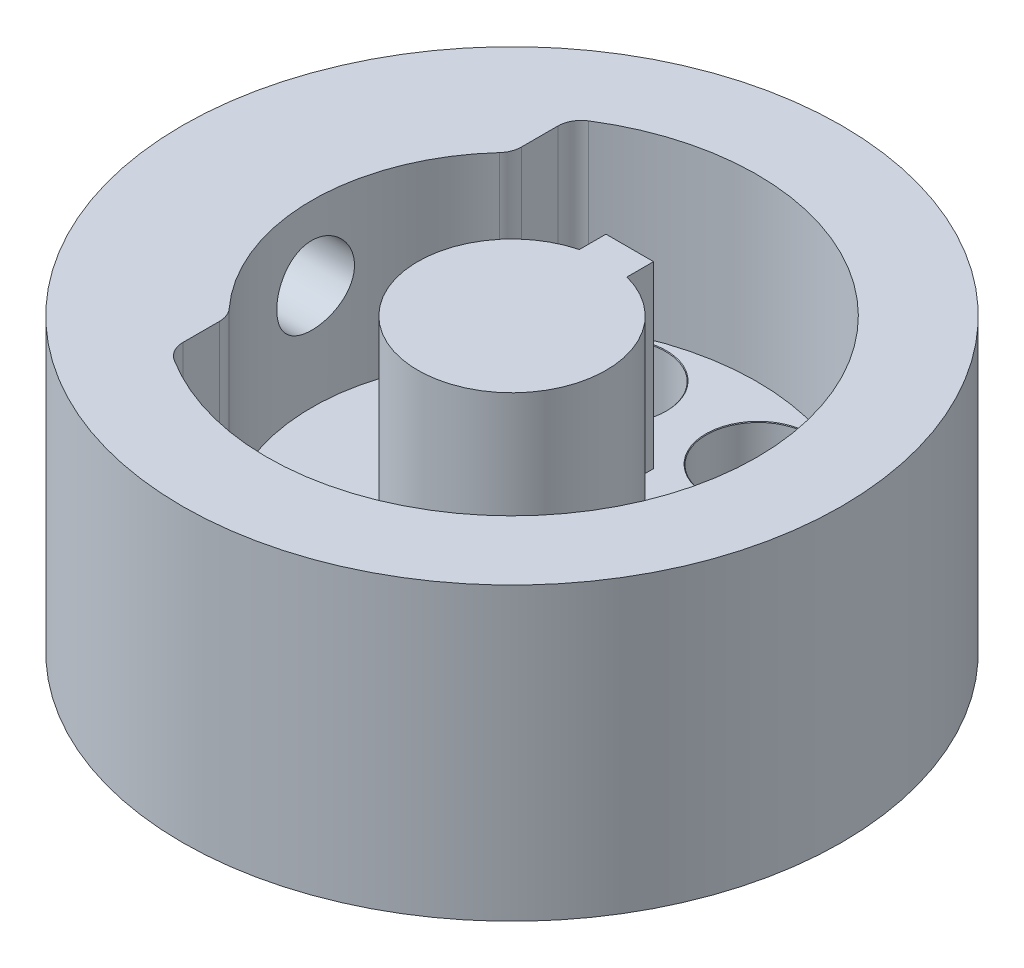
from build123d import *

# Parameters (mm, degrees)
SKETCH1_R                             = 14
BOSS_EXTRUDE1_DEPTH                   = 4.75
BOSS_EXTRUDE4_DEPTH                   = 7.61416499
BOSS_EXTRUDE5_START                   = 7.61416499
SKETCH5_R                             = 14
BOSS_EXTRUDE5_DEPTH                   = 7.61416499
TAP_DRILL_FOR_M4X0_7_TAP2_D           = 3.3
TAP_DRILL_FOR_M4X0_7_TAP2_DEPTH       = 13.749
TAP_DRILL_FOR_M4X0_7_TAP2_CSINK_D     = 3.35
TAP_DRILL_FOR_M4X0_7_TAP2_CSINK_ANGLE = 90
TAP_DRILL_FOR_M4X0_7_TAP2_TIP         = 0.991420021
FILLET2_R                             = 1
CBORE_FOR_M2_SHCS3_AT_2_COUNT         = 2
CBORE_FOR_M2_SHCS3_AT_2_PITCH         = 6.122934918
CBORE_FOR_M2_SHCS3_AT_3_COUNT         = 2
CBORE_FOR_M2_SHCS3_AT_3_PITCH         = 11.313708499
CBORE_FOR_M2_SHCS3_AT_4_COUNT         = 2
CBORE_FOR_M2_SHCS3_AT_4_PITCH         = 14.78207252
CBORE_FOR_M2_SHCS3_AT_5_COUNT         = 2
CBORE_FOR_M2_SHCS3_AT_5_PITCH         = 16
CBORE_FOR_M2_SHCS3_AT_6_COUNT         = 2
CBORE_FOR_M2_SHCS3_AT_6_PITCH         = 14.78207252
SKETCH20_R                            = 4
CUT_EXTRUDE2_DEPTH                    = 2.75
SKETCH21_R                            = 2
CUT_EXTRUDE3_DEPTH                    = 2.5


with BuildPart() as part:
    # Sketch1 → Boss-Extrude1 (new body)
    with BuildSketch(Plane(origin=(0, 0, 0), x_dir=(1, 0, 0), z_dir=(0, 1, 0))):
        with Locations(Location((0, 0, 0), (0, 0, 270))):
            Circle(SKETCH1_R)
    extrude(amount=-BOSS_EXTRUDE1_DEPTH)

    # Sketch4 → Boss-Extrude4 (add)
    with BuildSketch(Plane(origin=(0, 0, 0), x_dir=(1, 0, 0), z_dir=(0, 1, 0))):
        with BuildLine():
            ThreePointArc((4, 0), (3.165438358, 2.445403852), (1.01, 3.870387577))
            Line((1.01, 3.870387577), (-1.01, 3.870387577))
            ThreePointArc((-1.01, 3.870387577), (-2.445403852, -3.165438358), (4, 0))
        make_face()
        with BuildLine():
            Line((-1.01, 3.870387577), (1.01, 3.870387577))
            ThreePointArc((1.01, 3.870387577), (0, 4), (-1.01, 3.870387577))
        make_face()
        with BuildLine():
            Line((1.01, 3.870387577), (1.01, 4.999999997))
            Line((1.01, 4.999999997), (-1.01, 4.999999997))
            Line((-1.01, 4.999999997), (-1.01, 3.870387577))
            ThreePointArc((-1.01, 3.870387577), (0, 4), (1.01, 3.870387577))
        make_face()
    extrude(amount=BOSS_EXTRUDE4_DEPTH)

    # Sketch5 → Boss-Extrude5 (add)
    with BuildSketch(Plane(origin=(0, 0, 0), x_dir=(1, 0, 0), z_dir=(0, 1, 0)).offset(BOSS_EXTRUDE5_START)):
        with Locations(Location((0, 0, 0), (0, 0, 270))):
            Circle(SKETCH5_R)
        with BuildLine():
            ThreePointArc((-6.01040764, 8.487343518), (10.4, 0), (-6.01040764, -8.487343518))
            Line((-6.01040764, -8.487343518), (-6.01040764, -6.01040764))
            ThreePointArc((-6.01040764, -6.01040764), (-8.5, 0), (-6.01040764, 6.01040764))
            Line((-6.01040764, 6.01040764), (-6.01040764, 8.487343518))
        make_face(mode=Mode.SUBTRACT)
    extrude(amount=-BOSS_EXTRUDE5_DEPTH)

    # Tap Drill for M4x0.7 Tap2
    with Locations(Plane(origin=(-20, 0, 0), x_dir=(0, 0, -1), z_dir=(-1, 0, 0))):
        with Locations((0, -4.48916499)):
            CounterSinkHole(TAP_DRILL_FOR_M4X0_7_TAP2_D / 2, TAP_DRILL_FOR_M4X0_7_TAP2_CSINK_D / 2, depth=TAP_DRILL_FOR_M4X0_7_TAP2_DEPTH, counter_sink_angle=TAP_DRILL_FOR_M4X0_7_TAP2_CSINK_ANGLE)
            with Locations((0, 0, -(TAP_DRILL_FOR_M4X0_7_TAP2_DEPTH + TAP_DRILL_FOR_M4X0_7_TAP2_TIP / 2))):  # 118° drill point
                Cone(0, TAP_DRILL_FOR_M4X0_7_TAP2_D / 2, TAP_DRILL_FOR_M4X0_7_TAP2_TIP, mode=Mode.SUBTRACT)

    # Fillet2
    fillet2_edges = [part.edges().sort_by_distance(p)[0] for p in [
        (-6.01040764, 3.807082495, -8.487343518),
        (-6.01040764, 3.807082495, 8.487343518),
        (-6.01040764, 3.807082495, 6.01040764),
        (-6.01040764, 3.807082495, -6.01040764),
    ]]
    fillet(fillet2_edges, radius=FILLET2_R)

    # Sketch19 → CBORE for M2 SHCS3 (revolve, cut)
    with BuildSketch(Plane(origin=(-3.061467459, 0, -7.39103626), x_dir=(0, 0, 1), z_dir=(1, 0, 0))):
        Polygon((0, 0), (0, 5.471032743), (1.2, 4.75), (1.2, 3.5), (2.2, 3.5), (2.2, 0.025), (2.225, 0), align=None)
    cbore_for_m2_shcs3 = revolve(axis=Axis((-3.061467459, 6.35, -7.39103626), (0, -1, 0)), mode=Mode.SUBTRACT)

    # CBORE for M2 SHCS3 at 2: CBORE for M2 SHCS3 ×2
    with Locations(*[(i * CBORE_FOR_M2_SHCS3_AT_2_PITCH, 0, 0) for i in range(1, CBORE_FOR_M2_SHCS3_AT_2_COUNT)]):
        add(cbore_for_m2_shcs3, mode=Mode.SUBTRACT)

    # CBORE for M2 SHCS3 at 3: CBORE for M2 SHCS3 ×2
    with Locations(*[Vector(0.9238795325112845, 0, 0.38268343236509533) * (i * CBORE_FOR_M2_SHCS3_AT_3_PITCH) for i in range(1, CBORE_FOR_M2_SHCS3_AT_3_COUNT)]):
        add(cbore_for_m2_shcs3, mode=Mode.SUBTRACT)

    # CBORE for M2 SHCS3 at 4: CBORE for M2 SHCS3 ×2
    with Locations(*[Vector(0.7071067811865439, 0, 0.7071067811865512) * (i * CBORE_FOR_M2_SHCS3_AT_4_PITCH) for i in range(1, CBORE_FOR_M2_SHCS3_AT_4_COUNT)]):
        add(cbore_for_m2_shcs3, mode=Mode.SUBTRACT)

    # CBORE for M2 SHCS3 at 5: CBORE for M2 SHCS3 ×2
    with Locations(*[Vector(0.3826834323650841, 0, 0.9238795325112892) * (i * CBORE_FOR_M2_SHCS3_AT_5_PITCH) for i in range(1, CBORE_FOR_M2_SHCS3_AT_5_COUNT)]):
        add(cbore_for_m2_shcs3, mode=Mode.SUBTRACT)

    # CBORE for M2 SHCS3 at 6: CBORE for M2 SHCS3 ×2
    with Locations(*[(0, 0, i * CBORE_FOR_M2_SHCS3_AT_6_PITCH) for i in range(1, CBORE_FOR_M2_SHCS3_AT_6_COUNT)]):
        add(cbore_for_m2_shcs3, mode=Mode.SUBTRACT)

    # Sketch20 → Cut-Extrude2 (cut)
    with BuildSketch(Plane.XZ.offset(4.75)):
        with Locations(Location((0, 0, 0), (0, 0, 270))):
            Circle(SKETCH20_R)
    extrude(amount=-CUT_EXTRUDE2_DEPTH, mode=Mode.SUBTRACT)

    # Sketch21 → Cut-Extrude3 (cut)
    with BuildSketch(Plane(origin=(0, -2, 0), x_dir=(-1, 0, 0), z_dir=(0, -1, 0))):
        with Locations(Location((0, 0, 0), (0, 0, 90))):
            Circle(SKETCH21_R)
    extrude(amount=-CUT_EXTRUDE3_DEPTH, mode=Mode.SUBTRACT)


solid = part.part
